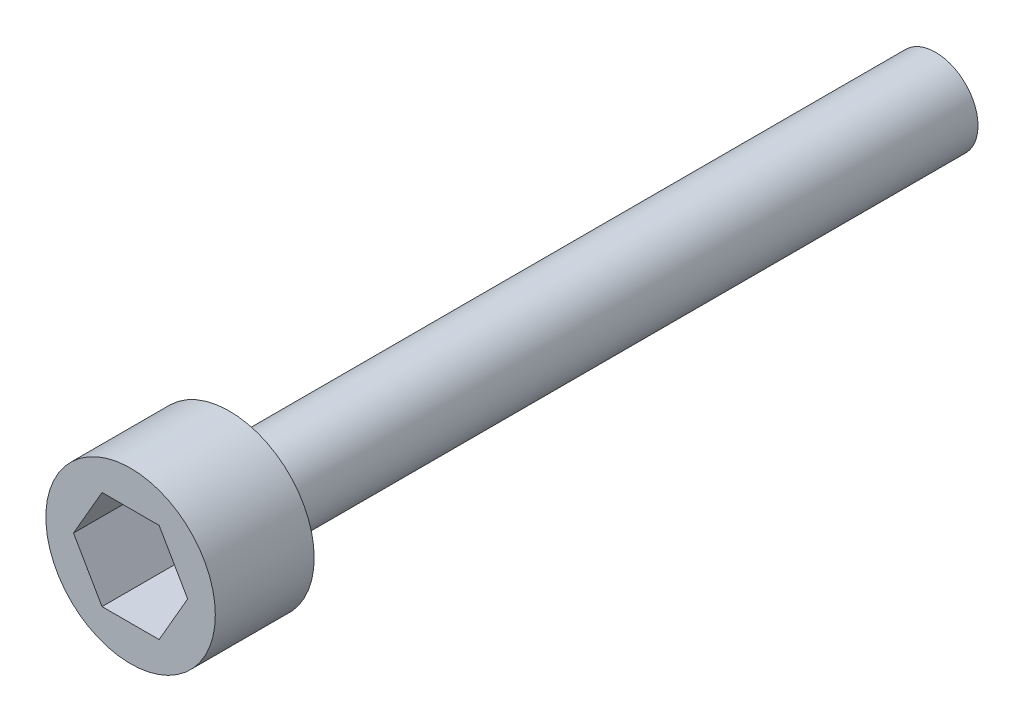
from build123d import *

# Parameters (mm, degrees)
SKETCH1_R                   = 3
HEAD_BOSS_EXTRUDE1_DEPTH    = 3.5
HEAD_HEX_CUT_EXTRUDE1_DEPTH = 2.8
SKETCH2_R                   = 1.5
SCREW_BOSS_EXTRUDE2_DEPTH   = 25


with BuildPart() as part:
    # Sketch1 → Head Boss-Extrude1 (new body)
    with BuildSketch(Plane.XY):
        Circle(SKETCH1_R)
    extrude(amount=HEAD_BOSS_EXTRUDE1_DEPTH)

    # Sketch3 → Head Hex Cut-Extrude1 (cut)
    with BuildSketch(Plane.XY.offset(3.5)):
        Polygon((-1.010362971, 1.75), (1.010362971, 1.75), (2.020725942, 0), (1.010362971, -1.75), (-1.010362971, -1.75), (-2.020725942, 0), align=None)
    extrude(amount=-HEAD_HEX_CUT_EXTRUDE1_DEPTH, mode=Mode.SUBTRACT)

    # Sketch2 → Screw Boss-Extrude2 (add)
    with BuildSketch(Plane.XY):
        Circle(SKETCH2_R)
    extrude(amount=-SCREW_BOSS_EXTRUDE2_DEPTH)


solid = part.part
